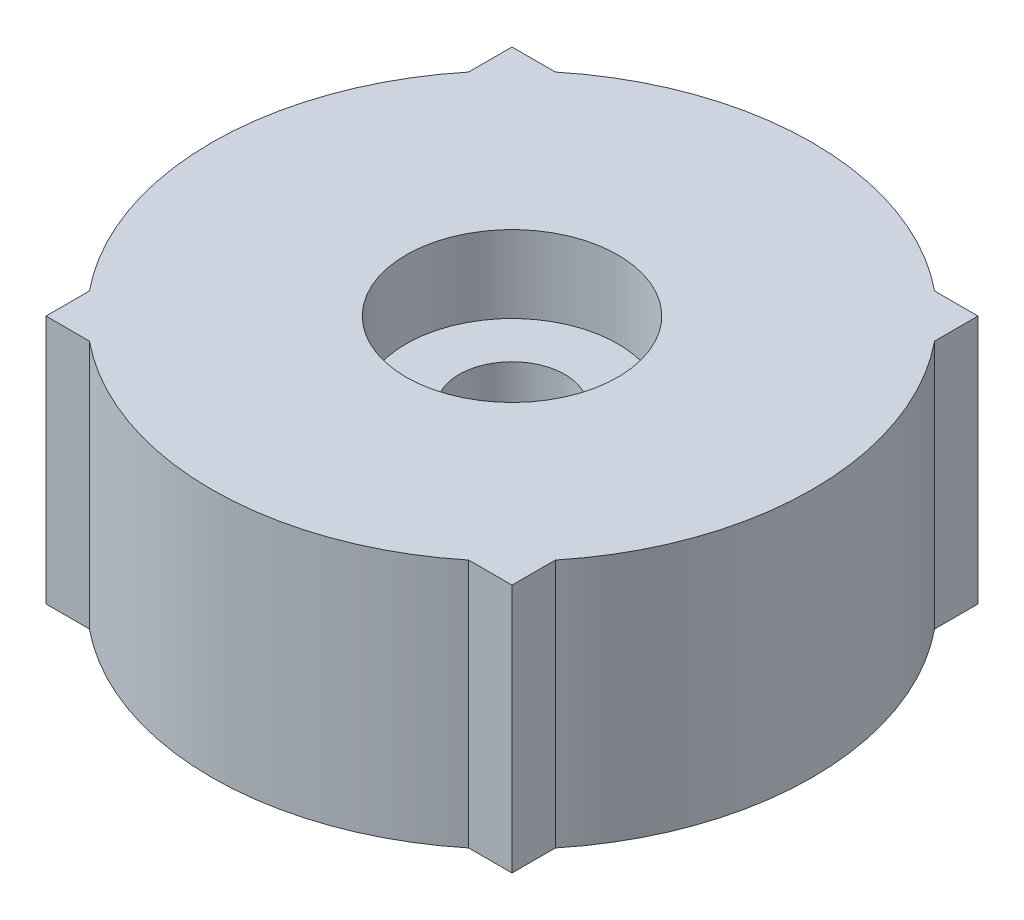
from build123d import *

# Parameters (mm, degrees)
SKETCH1_W           = 7.4
SKETCH1_H           = 7.4
SKETCH1_R           = 1.375
BOSS_EXTRUDE1_DEPTH = 2
SKETCH2_W           = 12.1
SKETCH2_H           = 12.1
SKETCH2_W_2         = 10.1
SKETCH2_H_2         = 10.1
BOSS_EXTRUDE2_DEPTH = 2
SKETCH3_W           = 12.1
SKETCH3_H           = 12.1
SKETCH3_R           = 2.75
BOSS_EXTRUDE3_DEPTH = 2
SKETCH4_R           = 2.75
SKETCH4_R_2         = 1.675
SKETCH4_R_3         = 1.375
BOSS_EXTRUDE4_DEPTH = 2
SKETCH5_R           = 1.675
BOSS_EXTRUDE5_DEPTH = 1.3
SKETCH10_W          = 12.1
SKETCH10_H          = 12.1
SKETCH10_W_2        = 10.1
SKETCH10_H_2        = 10.1
BOSS_EXTRUDE6_DEPTH = 3.175
SKETCH11_W          = 8.881017399
SKETCH11_H          = 18.09347602
CUT_EXTRUDE1_DEPTH  = 10
BOSS_EXTRUDE7_DEPTH = 6.475


with BuildPart() as part:
    # Sketch1 → Boss-Extrude1 (new body)
    with BuildSketch(Plane(origin=(0, 0, 0), x_dir=(1, 0, 0), z_dir=(0, 1, 0))):
        Rectangle(SKETCH1_W, SKETCH1_H)
        with Locations(Location((0, 0, 0), (0, 0, 270))):
            Circle(SKETCH1_R, mode=Mode.SUBTRACT)
    extrude(amount=BOSS_EXTRUDE1_DEPTH)



with BuildPart() as body_2:
    # Sketch2 → Boss-Extrude2 (new body)
    with BuildSketch(Plane(origin=(0, 2, 0), x_dir=(1, 0, 0), z_dir=(0, 1, 0))):
        Rectangle(SKETCH2_W, SKETCH2_H)
        Rectangle(SKETCH2_W_2, SKETCH2_H_2, mode=Mode.SUBTRACT)
    extrude(amount=-BOSS_EXTRUDE2_DEPTH)


with BuildPart() as part_1:
    add(part.part)

    add(body_2.part)  # Boss-Extrude3 merges body 2
    # Sketch3 → Boss-Extrude3 (add)
    with BuildSketch(Plane(origin=(0, 2, 0), x_dir=(1, 0, 0), z_dir=(0, 1, 0))):
        Rectangle(SKETCH3_W, SKETCH3_H)
        with Locations(Location((0, 0, 0), (0, 0, 270))):
            Circle(SKETCH3_R, mode=Mode.SUBTRACT)
    extrude(amount=BOSS_EXTRUDE3_DEPTH)

    # Sketch4 → Boss-Extrude4 (add)
    # profile 1 of 2: a face of its own
    with BuildSketch(Plane(origin=(0, 2, 0), x_dir=(1, 0, 0), z_dir=(0, 1, 0))):
        with BuildLine():
            Line((4, 0), (4, -20))
            ThreePointArc((4, -20), (0, -24), (-4, -20))
            Line((-4, -20), (-4, 0))
            ThreePointArc((-4, 0), (0, 4), (4, 0))
        make_face()
        with Locations(Location((0, 0, 0), (0, 0, 270))):
            Circle(SKETCH4_R, mode=Mode.SUBTRACT)
        with Locations(Location((0, -20, 0), (0, 0, 270))):
            Circle(SKETCH4_R_2, mode=Mode.SUBTRACT)
    # profile 2 of 2: a face of its own
    with BuildSketch(Plane(origin=(0, 2, 0), x_dir=(1, 0, 0), z_dir=(0, 1, 0))):
        with Locations(Location((0, 0, 0), (0, 0, 270))):
            Circle(SKETCH4_R_3)
    extrude(amount=BOSS_EXTRUDE4_DEPTH)


with BuildPart() as boss_extrude4_kept_piece:
    # of the separate pieces the step leaves, the one the design keeps (boss_extrude4_pieces_kept)
    add(part_1.part.solids().sort_by_distance((-3.7, 0, 3.7))[0])

    # Sketch5 → Boss-Extrude5 (add)
    # profile 1 of 2: a face of its own
    with BuildSketch(Plane(origin=(0, 2, 0), x_dir=(-1, 0, 0), z_dir=(0, -1, 0))):
        with BuildLine():
            ThreePointArc((-4, -20), (0, -16), (4, -20))
            Line((4, -20), (4, -6.05))
            Line((4, -6.05), (-4, -6.05))
            Line((-4, -6.05), (-4, -20))
        make_face()
    # profile 2 of 2: a face of its own
    with BuildSketch(Plane(origin=(0, 2, 0), x_dir=(-1, 0, 0), z_dir=(0, -1, 0))):
        with BuildLine():
            ThreePointArc((-4, -20), (0, -24), (4, -20))
            ThreePointArc((4, -20), (0, -16), (-4, -20))
        make_face()
        with Locations(Location((0, -20, 0), (0, 0, 90))):
            Circle(SKETCH5_R, mode=Mode.SUBTRACT)
    extrude(amount=BOSS_EXTRUDE5_DEPTH)

    # Sketch10 → Boss-Extrude6 (add)
    with BuildSketch(Plane.XZ.offset(-0.7)):
        Rectangle(SKETCH10_W, SKETCH10_H)
        Rectangle(SKETCH10_W_2, SKETCH10_H_2, mode=Mode.SUBTRACT)
    extrude(amount=BOSS_EXTRUDE6_DEPTH)

    # Sketch11 → Cut-Extrude1 (cut)
    with BuildSketch(Plane(origin=(0, 0.7, 0), x_dir=(-1, 0, 0), z_dir=(0, -1, 0))):
        with Locations((-0.4405087, -15.09673801)):
            Rectangle(SKETCH11_W, SKETCH11_H)
    extrude(amount=-CUT_EXTRUDE1_DEPTH, mode=Mode.SUBTRACT)

    # Sketch14 → Boss-Extrude7 (add)
    with BuildSketch(Plane(origin=(0, -2.475, 0), x_dir=(-1, 0, 0), z_dir=(0, -1, 0))):
        with BuildLine():
            Line((-4.923159555, 6.05), (4.923159555, 6.05))
            ThreePointArc((4.923159555, 6.05), (0, 7.8), (-4.923159555, 6.05))
        make_face()
        with BuildLine():
            ThreePointArc((6.05, -4.923159555), (7.8, 0), (6.05, 4.923159555))
            Line((6.05, 4.923159555), (6.05, -4.923159555))
        make_face()
        with BuildLine():
            Line((-6.05, -4.923159555), (-6.05, 4.923159555))
            ThreePointArc((-6.05, 4.923159555), (-7.8, 0), (-6.05, -4.923159555))
        make_face()
        with BuildLine():
            ThreePointArc((-4.923159555, -6.05), (0, -7.8), (4.923159555, -6.05))
            Line((4.923159555, -6.05), (-4.923159555, -6.05))
        make_face()
    extrude(amount=-BOSS_EXTRUDE7_DEPTH)


solid = boss_extrude4_kept_piece.part
